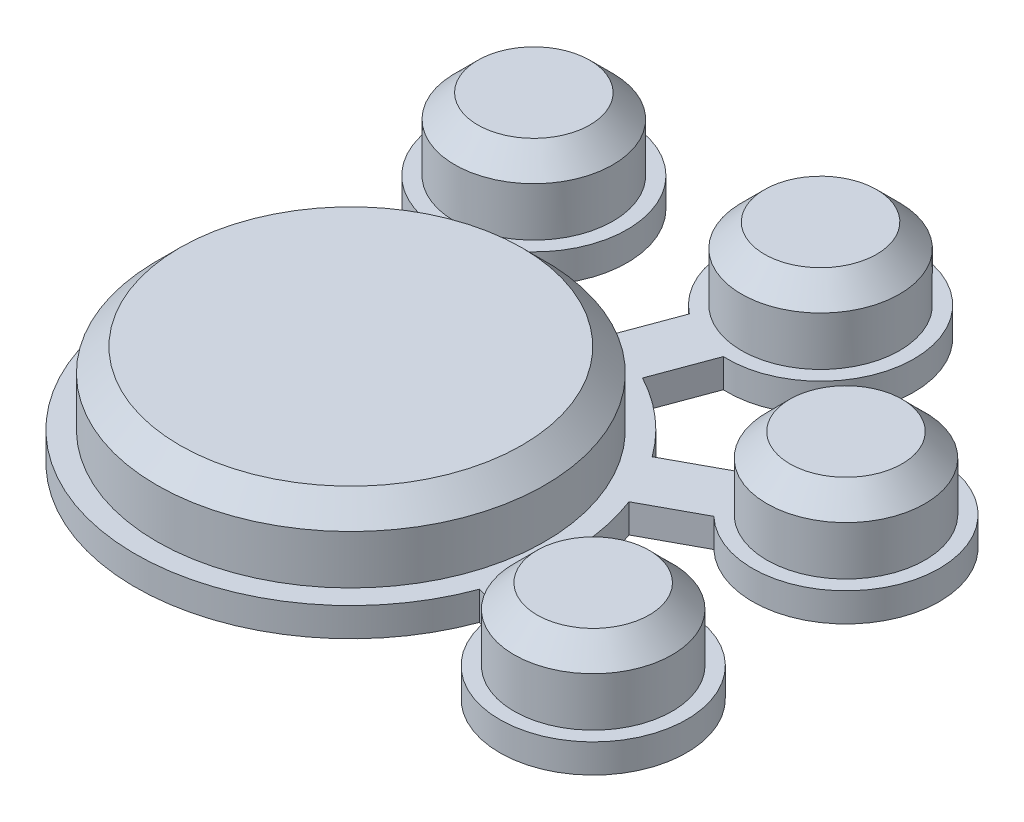
from build123d import *

# Parameters (mm, degrees)
SKETCH_1_R      = 3.25
SKETCH_1_R_2    = 7.5
EXTRUDE_1_DEPTH = 1
SKETCH_2_R      = 6.75
SKETCH_2_R_2    = 2.75
EXTRUDE_2_DEPTH = 2.5
CHAMFER_1_SIZE  = 0.8
SKETCH_3_R      = 1
EXTRUDE_3_DEPTH = 0.55


with BuildPart() as part:
    # 草图1 → 凸台-拉伸1 (new body)
    with BuildSketch(Plane(origin=(0, 0, 0), x_dir=(1, 0, 0), z_dir=(0, 1, 0))):
        with Locations((-4.465418824, 10.828840308)):
            Circle(SKETCH_1_R)
        with BuildLine():
            Line((-3.953247825, 7.619450823), (-3.538203787, 6.612950473))
            ThreePointArc((-3.538203787, 6.612950473), (-2.859173271, 6.933623022), (-2.151479183, 7.184785127))
            Line((-2.151479183, 7.184785127), (-2.56652322, 8.191285477))
            ThreePointArc((-2.56652322, 8.191285477), (-3.22644374, 7.824270332), (-3.953247825, 7.619450823))
        make_face()
        Circle(SKETCH_1_R_2)
        with Locations((4.416088752, 11.919352316)):
            Circle(SKETCH_1_R)
        with BuildLine():
            Line((2.404044607, 9.367063468), (1.64466801, 7.317449497))
            ThreePointArc((1.64466801, 7.317449497), (2.605643113, 7.03282475), (3.520087943, 6.622611333))
            Line((3.520087943, 6.622611333), (4.279464541, 8.672225305))
            ThreePointArc((4.279464541, 8.672225305), (3.286976736, 8.871794924), (2.404044607, 9.367063468))
        make_face()
        with BuildLine():
            ThreePointArc((6.059916763, 4.418982782), (6.595006984, 3.571537887), (7.012326866, 2.660314252))
            Line((7.012326866, 2.660314252), (8.926399669, 3.696883819))
            ThreePointArc((8.926399669, 3.696883819), (8.311549297, 4.501134462), (7.973989566, 5.455552349))
            Line((7.973989566, 5.455552349), (6.059916763, 4.418982782))
        make_face()
        with Locations((11.169385657, 6.048800879)):
            Circle(SKETCH_1_R)
        with Locations((11.325553388, -2.898042413)):
            Circle(SKETCH_1_R)
        with BuildLine():
            Line((7.043551493, -2.576505845), (8.076059132, -2.840709353))
            ThreePointArc((8.076059132, -2.840709353), (8.176998527, -2.092373567), (8.447906292, -1.387530186))
            Line((8.447906292, -1.387530186), (7.415398652, -1.123326679))
            ThreePointArc((7.415398652, -1.123326679), (7.265895832, -1.859235798), (7.043551493, -2.576505845))
        make_face()
    extrude(amount=EXTRUDE_1_DEPTH)

    # 草图2 → 凸台-拉伸2 (add)
    with BuildSketch(Plane(origin=(0, 1, 0), x_dir=(1, 0, 0), z_dir=(0, 1, 0))):
        with Locations(Location((0, 0, 0), (0, 0, 270))):
            Circle(SKETCH_2_R)
        with Locations(Location((-4.465418824, 10.828840308, 0), (0, 0, 270))):
            Circle(SKETCH_2_R_2)
        with Locations(Location((4.416088752, 11.919352316, 0), (0, 0, 270))):
            Circle(SKETCH_2_R_2)
        with Locations(Location((11.169385657, 6.048800879, 0), (0, 0, 270))):
            Circle(SKETCH_2_R_2)
        with Locations(Location((11.325553388, -2.898042413, 0), (0, 0, 270))):
            Circle(SKETCH_2_R_2)
    extrude(amount=EXTRUDE_2_DEPTH)

    # 倒角1
    chamfer_1_edges = [part.edges().sort_by_distance(p)[0] for p in [
        (0, 3.5, -6.75),
        (-4.465418824, 3.5, -13.578840308),
        (4.416088752, 3.5, -14.669352316),
        (11.169385657, 3.5, -8.798800879),
        (11.325553388, 3.5, 0.148042413),
    ]]
    chamfer(chamfer_1_edges, length=CHAMFER_1_SIZE)

    # 草图3 → 凸台-拉伸3 (add)
    with BuildSketch(Plane.XZ):
        with Locations(Location((0, 0, 0), (0, 0, 90))):
            Circle(SKETCH_3_R)
        with Locations(Location((11.325553388, 2.898042413, 0), (0, 0, 90))):
            Circle(SKETCH_3_R)
        with Locations(Location((11.169385657, -6.048800879, 0), (0, 0, 90))):
            Circle(SKETCH_3_R)
        with Locations(Location((4.416088752, -11.919352316, 0), (0, 0, 90))):
            Circle(SKETCH_3_R)
        with Locations(Location((-4.465418824, -10.828840308, 0), (0, 0, 90))):
            Circle(SKETCH_3_R)
    extrude(amount=EXTRUDE_3_DEPTH)


solid = part.part
